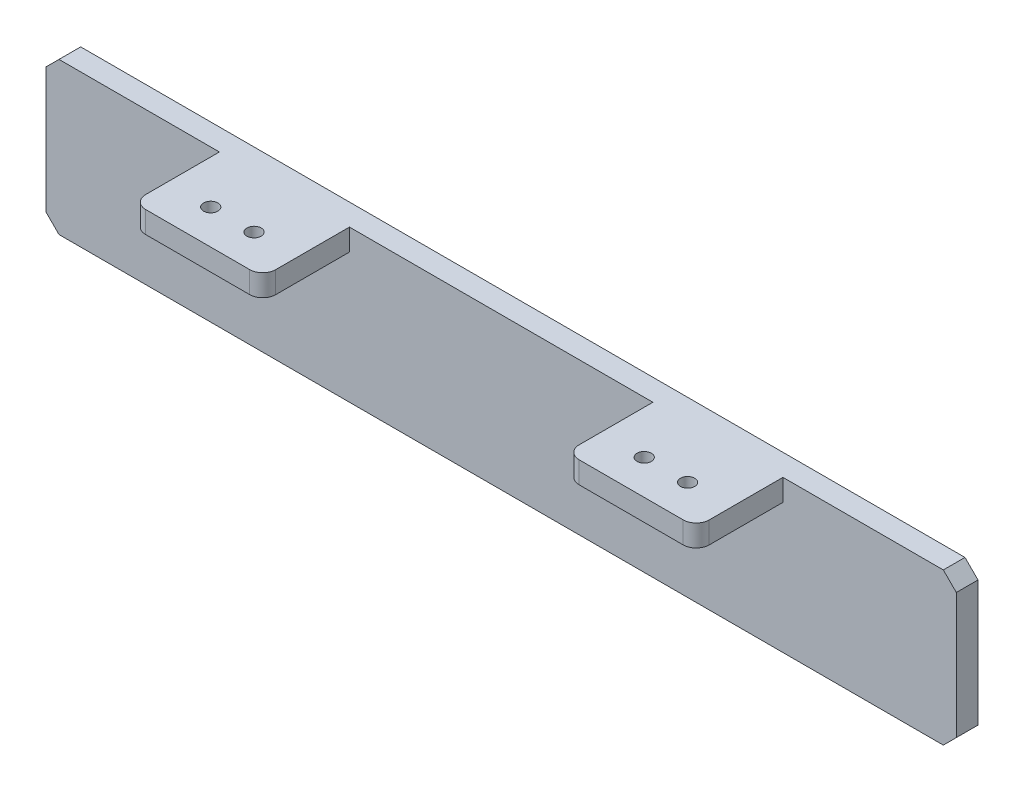
from build123d import *

# Parameters (mm, degrees)
SKETCH_1_W          = 210
SKETCH_1_H          = 35
EXTRUDE_1_DEPTH     = 5
SKETCH_2_W          = 30
SKETCH_2_H          = 5
EXTRUDE_2_DEPTH     = 20
SKETCH_3_R          = 1.65
CUT_EXTRUDE_1_DEPTH = 10
FILLET_1_R          = 3
CHAMFER_1_SIZE      = 3


with BuildPart() as part:
    # 草图1 → 凸台-拉伸1 (new body)
    with BuildSketch(Plane.XY):
        with Locations((105, 17.5)):
            Rectangle(SKETCH_1_W, SKETCH_1_H)
    extrude(amount=EXTRUDE_1_DEPTH)

    # 草图2 → 凸台-拉伸2 (add)
    with BuildSketch(Plane.XY.offset(5)):
        with Locations((55, 32.5)):
            Rectangle(SKETCH_2_W, SKETCH_2_H)
        with Locations((155, 32.5)):
            Rectangle(SKETCH_2_W, SKETCH_2_H)
    extrude(amount=EXTRUDE_2_DEPTH)

    # 草图3 → 切除-拉伸1 (cut)
    with BuildSketch(Plane(origin=(0, 35, 0), x_dir=(1, 0, 0), z_dir=(0, 1, 0))):
        with Locations(Location((160, -17, 0), (0, 0, 270))):
            Circle(SKETCH_3_R)
        with Locations(Location((150, -17, 0), (0, 0, 270))):
            Circle(SKETCH_3_R)
        with Locations(Location((60, -17, 0), (0, 0, 270))):
            Circle(SKETCH_3_R)
        with Locations(Location((50, -17, 0), (0, 0, 270))):
            Circle(SKETCH_3_R)
    extrude(amount=-CUT_EXTRUDE_1_DEPTH, mode=Mode.SUBTRACT)

    # 圆角1
    fillet_1_edges = [part.edges().sort_by_distance(p)[0] for p in [
        (40, 32.5, 25),
        (70, 32.5, 25),
        (140, 32.5, 25),
        (170, 32.5, 25),
    ]]
    fillet(fillet_1_edges, radius=FILLET_1_R)

    # 倒角1
    chamfer_1_edges = [part.edges().sort_by_distance(p)[0] for p in [
        (0, 35, 2.5),
        (210, 35, 2.5),
        (210, 0, 2.5),
        (0, 0, 2.5),
    ]]
    chamfer(chamfer_1_edges, length=CHAMFER_1_SIZE)


solid = part.part
